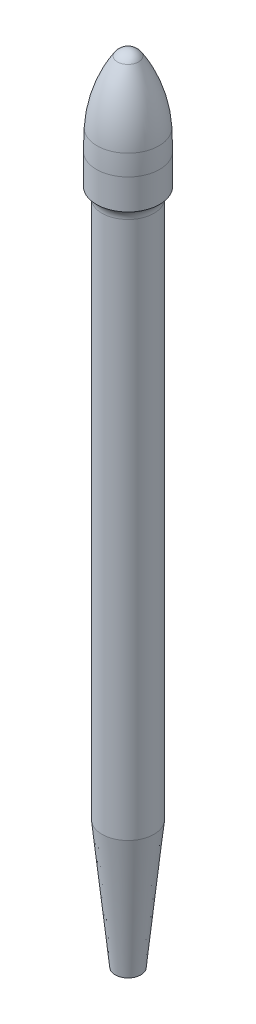
from build123d import *


with BuildPart() as part:
    # Esboço1 → Revolução1 (revolve)
    with BuildSketch(Plane.XY, mode=Mode.PRIVATE) as revolu_o1_sk:
        with BuildLine():
            Line((-1.025, 5.08), (-0.51, 0))
            Line((-0.51, 0), (0, 0))
            Line((0, 0), (0, 31.5))
            ThreePointArc((0, 31.5), (-0.237708503, 31.439880288), (-0.418253138, 31.273978671))
            ThreePointArc((-0.418253138, 31.273978671), (-0.987090573, 30.091270748), (-1.228582631, 28.801287941))
            ThreePointArc((-1.228582631, 28.801287941), (-1.244644702, 28.400787059), (-1.25, 28))
            Line((-1.25, 28), (-1.25, 26.8))
            ThreePointArc((-1.25, 26.8), (-1.084829578, 26.619588497), (-1.025, 26.382417673))
            Line((-1.025, 26.382417673), (-1.025, 5.08))
        make_face()
    revolve(revolu_o1_sk.sketch.rotate(Axis((0, 0, 0), (0, 1, 0)), 270), axis=Axis((0, 0, 0), (0, 1, 0)))


solid = part.part
